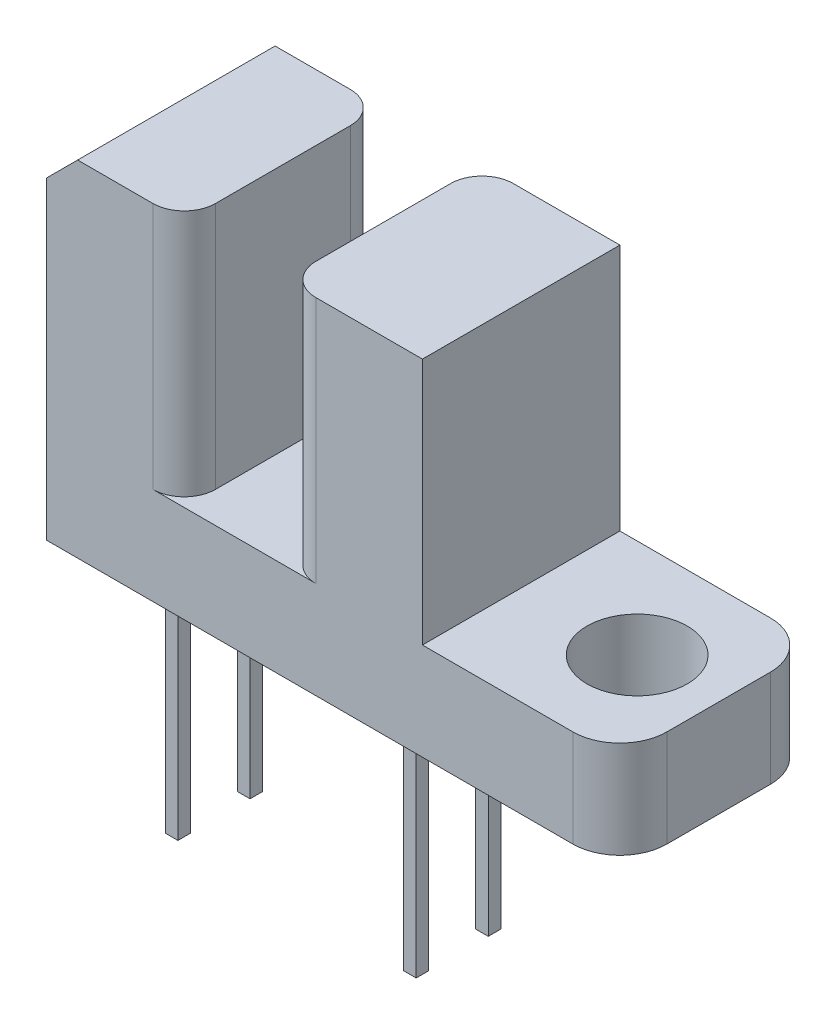
from build123d import *

# Parameters (mm, degrees)
SKETCH1_W                  = 18.3
SKETCH1_H                  = 6.3
BOSS_EXTRUDE1_DEPTH        = 3.1
FILLET1_R                  = 1.5
SKETCH2_W                  = 12
SKETCH2_H                  = 6.3
BOSS_EXTRUDE2_DEPTH        = 7.9
F_3_2_3_2_DIAMETER_HOLE1_D = 3.2
SKETCH5_W                  = 3.2
SKETCH5_H                  = 7.9
CUT_EXTRUDE1_DEPTH         = 16.633697579
CHAMFER1_SIZE              = 1
FILLET2_R                  = 1
SKETCH6_W                  = 0.4
SKETCH6_H                  = 0.4
BOSS_EXTRUDE3_DEPTH        = 8
LPATTERN1_COUNT            = 2
LPATTERN1_PITCH            = 7.6


with BuildPart() as part:
    # Sketch1 → Boss-Extrude1 (new body)
    with BuildSketch(Plane(origin=(0, 0, 0), x_dir=(1, 0, 0), z_dir=(0, 1, 0))):
        Rectangle(SKETCH1_W, SKETCH1_H)
    extrude(amount=BOSS_EXTRUDE1_DEPTH)

    # Fillet1
    fillet1_edges = [part.edges().sort_by_distance(p)[0] for p in [
        (9.15, 1.55, 3.15),
        (9.15, 1.55, -3.15),
    ]]
    fillet(fillet1_edges, radius=FILLET1_R)

    # Sketch2 → Boss-Extrude2 (add)
    with BuildSketch(Plane(origin=(0, 3.1, 0), x_dir=(1, 0, 0), z_dir=(0, 1, 0))):
        with Locations((-3.15, 0)):
            Rectangle(SKETCH2_W, SKETCH2_H)
    extrude(amount=BOSS_EXTRUDE2_DEPTH)

    # Ø3.2 (3.2) Diameter Hole1 (through all)
    with Locations(Plane(origin=(0, 3.1, 0), x_dir=(1, 0, 0), z_dir=(0, 1, 0))):
        with Locations((6.55, 0)):
            Hole(F_3_2_3_2_DIAMETER_HOLE1_D / 2)

    # Sketch5 → Cut-Extrude1 (cut, through all)
    with BuildSketch(Plane.XY.offset(3.15)):
        with Locations((-3.15, 7.05)):
            Rectangle(SKETCH5_W, SKETCH5_H)
    extrude(amount=-CUT_EXTRUDE1_DEPTH, mode=Mode.SUBTRACT)

    # Chamfer1
    chamfer1_edges = [part.edges().sort_by_distance(p)[0] for p in [
        (-9.15, 11, 0),
    ]]
    chamfer(chamfer1_edges, length=CHAMFER1_SIZE)

    # Fillet2
    fillet2_edges = [part.edges().sort_by_distance(p)[0] for p in [
        (-4.75, 7.05, -3.15),
        (-1.55, 7.05, -3.15),
        (-4.75, 7.05, 3.15),
        (-1.55, 7.05, 3.15),
    ]]
    fillet(fillet2_edges, radius=FILLET2_R)

    # Sketch6 → Boss-Extrude3 (add)
    with BuildSketch(Plane.XZ):
        with Locations((0.65, 1.15)):
            Rectangle(SKETCH6_W, SKETCH6_H)
        with Locations((0.65, -1.15)):
            Rectangle(SKETCH6_W, SKETCH6_H)
    boss_extrude3 = extrude(amount=BOSS_EXTRUDE3_DEPTH)

    # LPattern1: Boss-Extrude3 ×2
    with Locations(*[(-i * LPATTERN1_PITCH, 0, 0) for i in range(1, LPATTERN1_COUNT)]):
        add(boss_extrude3)


solid = part.part
